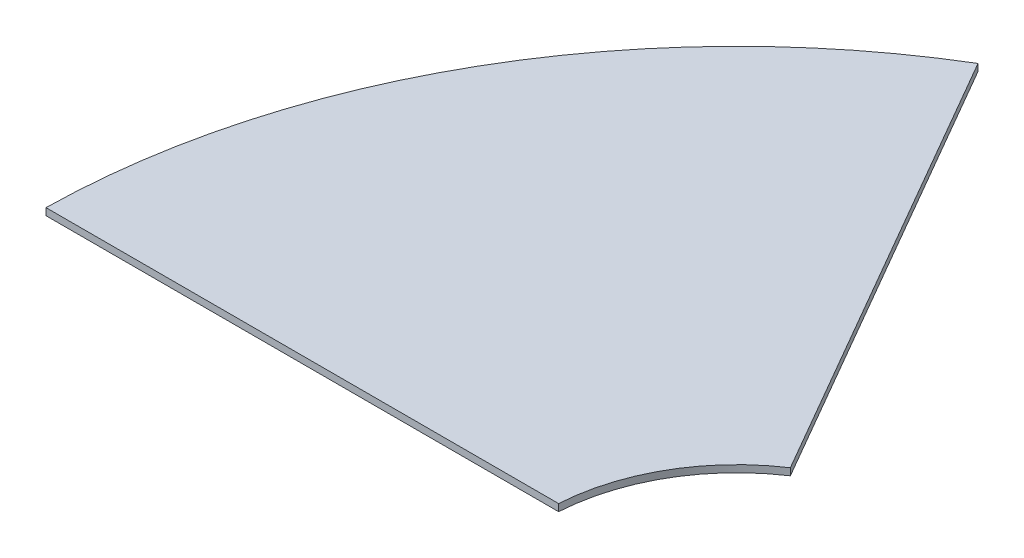
from build123d import *

# Parameters (mm, degrees)
BOSS_EXTRUDE1_DEPTH = 6


with BuildPart() as part:
    # Sketch1 → Boss-Extrude1 (new body)
    with BuildSketch(Plane(origin=(0, 0, 0), x_dir=(1, 0, 0), z_dir=(0, 1, 0))):
        with BuildLine():
            ThreePointArc((-521.750777563, 295.459449184), (-519.268832109, 299.8), (-516.750777563, 304.119703222))
            ThreePointArc((-516.750777563, 304.119703222), (-425.745445365, 422.209634839), (-308.418556675, 514.196610158))
            Line((-308.418556675, 514.196610158), (-176.260254038, 285.291715349))
            Line((-176.260254038, 285.291715349), (-171.260254038, 276.631461311))
            Line((-171.260254038, 276.631461311), (-89.706166951, 135.375638912))
            ThreePointArc((-89.706166951, 135.375638912), (-140.642525575, 81.2), (-162.091825827, 10))
            Line((-162.091825827, 10), (-325.2, 10))
            Line((-325.2, 10), (-335.2, 10))
            Line((-335.2, 10), (-599.516605275, 10))
            ThreePointArc((-599.516605275, 10), (-578.516992176, 157.601553812), (-521.750777563, 295.459449184))
        make_face()
    extrude(amount=BOSS_EXTRUDE1_DEPTH)


solid = part.part
